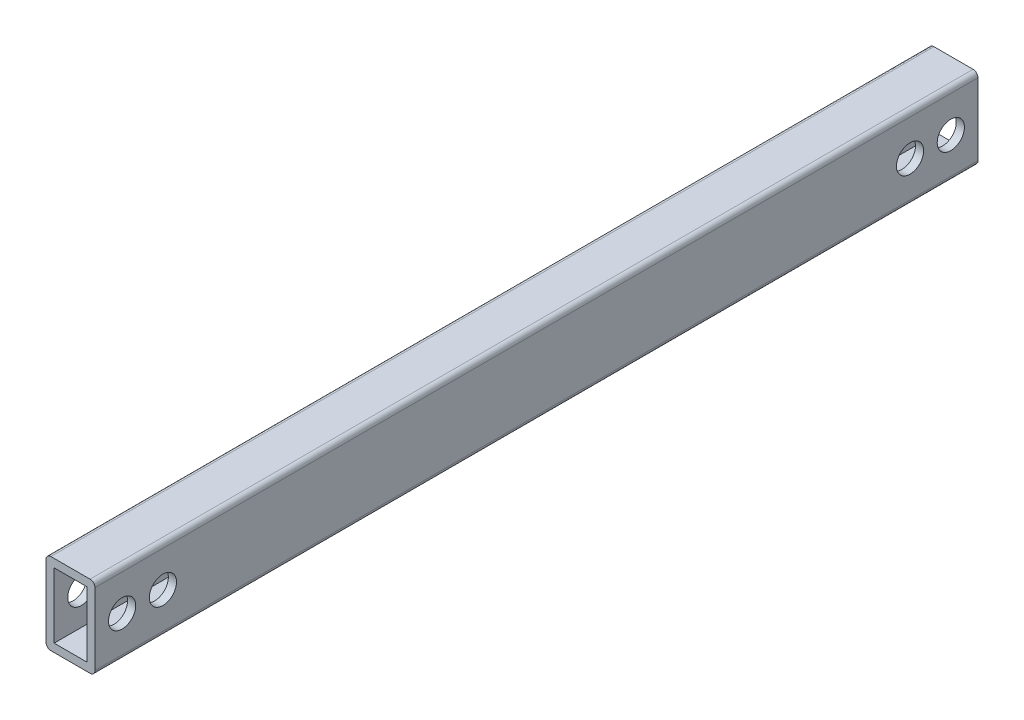
from build123d import *

# Parameters (mm, degrees)
SKETCH1_W         = 18
SKETCH1_H         = 30
SKETCH1_W_2       = 12
SKETCH1_H_2       = 24
BODY_DEPTH        = 324.79860434
SKETCH2_R         = 5
MOUNT_HOLES_DEPTH = 326.642646748
CORNER_FILLETS_R  = 1.8


with BuildPart() as part:
    # Sketch1 → Body (new body)
    with BuildSketch(Plane.XY):
        Rectangle(SKETCH1_W, SKETCH1_H)
        Rectangle(SKETCH1_W_2, SKETCH1_H_2, mode=Mode.SUBTRACT)
    extrude(amount=BODY_DEPTH)

    # Sketch2 → Mount Holes (cut, through all)
    with BuildSketch(Plane(origin=(9, 0, 0), x_dir=(0, 0, -1), z_dir=(1, 0, 0))):
        with Locations((-314.79860434, 0)):
            Circle(SKETCH2_R)
        with Locations((-299.79860434, 0)):
            Circle(SKETCH2_R)
        with Locations(Location((-25, 0, 0), (0, 0, 180))):
            Circle(SKETCH2_R)
        with Locations(Location((-10, 0, 0), (0, 0, 180))):
            Circle(SKETCH2_R)
    extrude(amount=-MOUNT_HOLES_DEPTH, mode=Mode.SUBTRACT)

    # Corner Fillets
    corner_fillets_edges = [part.edges().sort_by_distance(p)[0] for p in [
        (-9, 15, 162.39930217),
        (9, 15, 162.39930217),
        (9, -15, 162.39930217),
        (-9, -15, 162.39930217),
    ]]
    fillet(corner_fillets_edges, radius=CORNER_FILLETS_R)


solid = part.part
